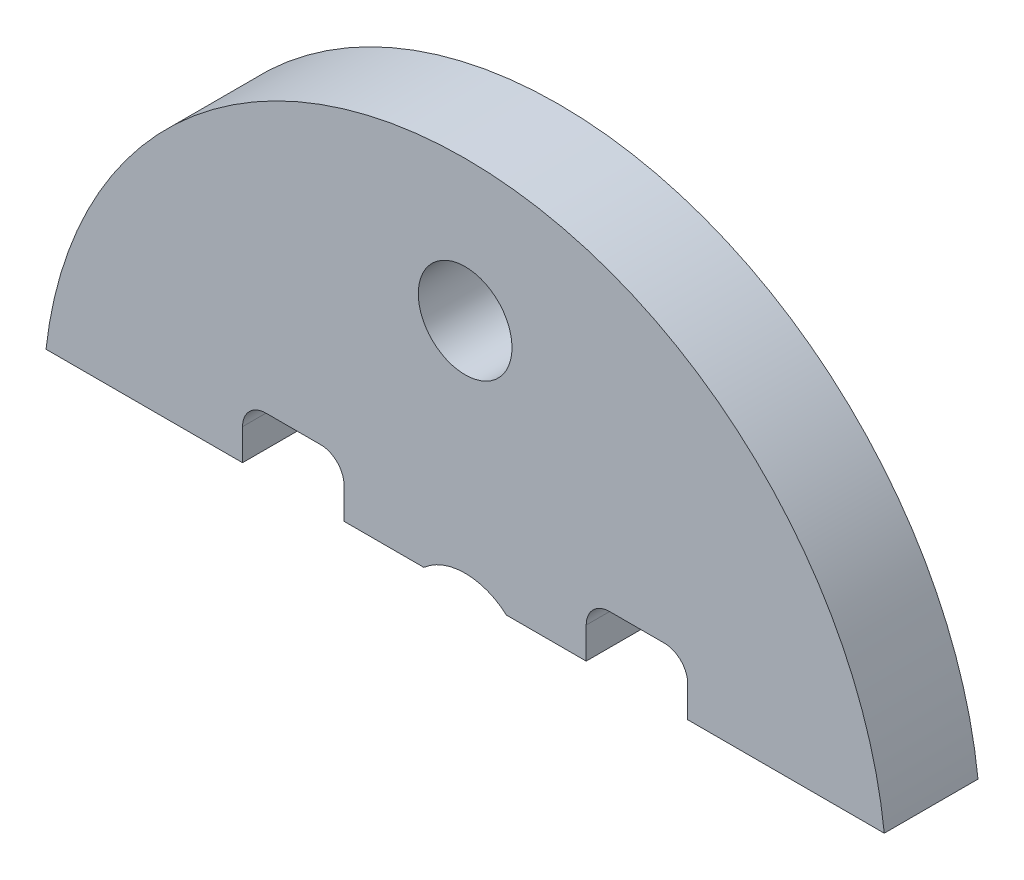
from build123d import *

# Parameters (mm, degrees)
MODEL_R                 = 1.5
SALIENTE_EXTRUIR1_DEPTH = 3


with BuildPart() as part:
    # Model → Saliente-Extruir1 (new body)
    with BuildSketch(Plane.XY):
        with BuildLine():
            Line((21.294846678, 286.126884365), (18.742722334, 286.126884365))
            Line((18.742722334, 286.126884365), (18.742722334, 287.126884365))
            ThreePointArc((18.742722334, 287.126884365), (18.523052419, 287.657214451), (17.992722334, 287.876884365))
            Line((17.992722334, 287.876884365), (16.242722334, 287.876884365))
            ThreePointArc((16.242722334, 287.876884365), (15.712392248, 287.657214451), (15.492722334, 287.126884365))
            Line((15.492722334, 287.126884365), (15.492722334, 286.126884365))
            Line((15.492722334, 286.126884365), (9.201314468, 286.126884365))
            ThreePointArc((9.201314468, 286.126884365), (22.617722333, 298.126884365), (36.034130199, 286.126884365))
            Line((36.034130199, 286.126884365), (29.742722334, 286.126884365))
            Line((29.742722334, 286.126884365), (29.742722334, 287.126884365))
            ThreePointArc((29.742722334, 287.126884365), (29.523052419, 287.657214451), (28.992722334, 287.876884365))
            Line((28.992722334, 287.876884365), (27.242722334, 287.876884365))
            ThreePointArc((27.242722334, 287.876884365), (26.712392248, 287.657214451), (26.492722334, 287.126884365))
            Line((26.492722334, 287.126884365), (26.492722334, 286.126884365))
            Line((26.492722334, 286.126884365), (23.940597989, 286.126884365))
            ThreePointArc((23.940597989, 286.126884365), (22.617722333, 286.626884365), (21.294846678, 286.126884365))
        make_face()
        with Locations((22.617722334, 293.626884365)):
            Circle(MODEL_R, mode=Mode.SUBTRACT)
    extrude(amount=SALIENTE_EXTRUIR1_DEPTH)


solid = part.part
